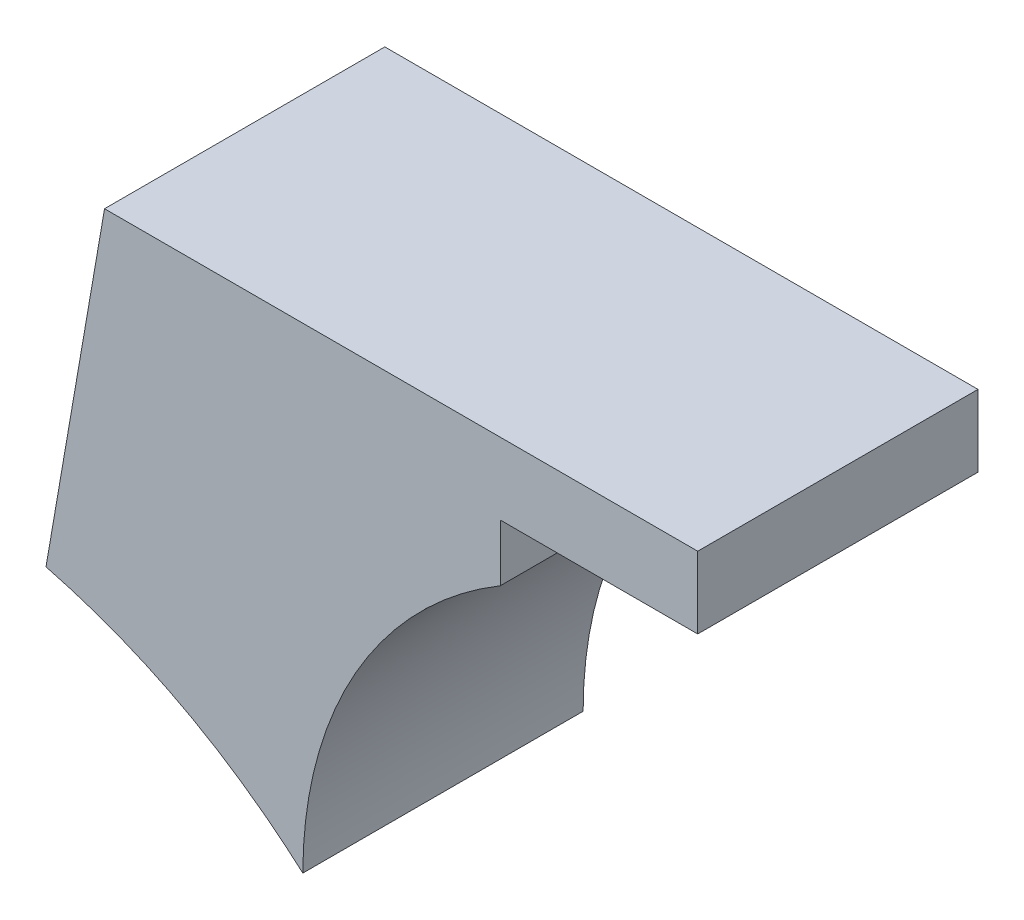
from build123d import *

# Parameters (mm, degrees)
RIGHTM_DEPTH = 30
LEFTM_START  = -30
LEFTM_DEPTH  = 30


with BuildPart() as part:
    # Sketch1 → rightM (new body)
    with BuildSketch(Plane.XY):
        Polygon((149.855864514, 43.874842), (149.855864514, 28.52351163), (192.119809278, 28.52351163), (234.383754043, 28.52351163), (234.383754043, 43.874842), (192.853964769, 43.874842), align=None)
        with BuildLine():
            Line((149.855864514, 28.52351163), (149.855864514, -58.067716007))
            ThreePointArc((149.855864514, -58.067716007), (156.250771623, -25.404082318), (174.491218383, 2.436426025))
            ThreePointArc((174.491218383, 2.436426025), (182.853494659, 9.95749243), (192.119809278, 16.331621214))
            Line((192.119809278, 16.331621214), (192.119809278, 28.52351163))
            Line((192.119809278, 28.52351163), (149.855864514, 28.52351163))
        make_face()
        with BuildLine():
            Line((107.405043491, 43.874842), (94.874715104, -28.778692489))
            add(Edge.make_bspline(
                [(94.874715104, -28.778692489), (125.81929731, -36.765852729), (149.855864514, -58.067716007)],
                knots=[0, 0, 0, 1, 1, 1], degree=2))
            Line((149.855864514, -58.067716007), (149.855864514, 43.874842))
            Line((149.855864514, 43.874842), (107.405043491, 43.874842))
        make_face()
    extrude(amount=RIGHTM_DEPTH)

    # Sketch2 → leftM (add)
    with BuildSketch(Plane.XY.offset(LEFTM_START)):
        Polygon((149.855864514, 43.874842), (149.855864514, 28.52351163), (192.119809278, 28.52351163), (234.383754043, 28.52351163), (234.383754043, 43.874842), (192.853964769, 43.874842), align=None)
        with BuildLine():
            Line((107.405043491, 43.874842), (94.874715104, -28.778692489))
            add(Edge.make_bspline(
                [(94.874715104, -28.778692489), (125.81929731, -36.765852729), (149.855864514, -58.067716007)],
                knots=[0, 0, 0, 1, 1, 1], degree=2))
            Line((149.855864514, -58.067716007), (149.855864514, 43.874842))
            Line((149.855864514, 43.874842), (107.405043491, 43.874842))
        make_face()
        with BuildLine():
            Line((149.855864514, 28.52351163), (149.855864514, -58.067716007))
            ThreePointArc((149.855864514, -58.067716007), (156.250771623, -25.404082318), (174.491218383, 2.436426025))
            ThreePointArc((174.491218383, 2.436426025), (182.853494659, 9.95749243), (192.119809278, 16.331621214))
            Line((192.119809278, 16.331621214), (192.119809278, 28.52351163))
            Line((192.119809278, 28.52351163), (149.855864514, 28.52351163))
        make_face()
    extrude(amount=LEFTM_DEPTH)


solid = part.part
